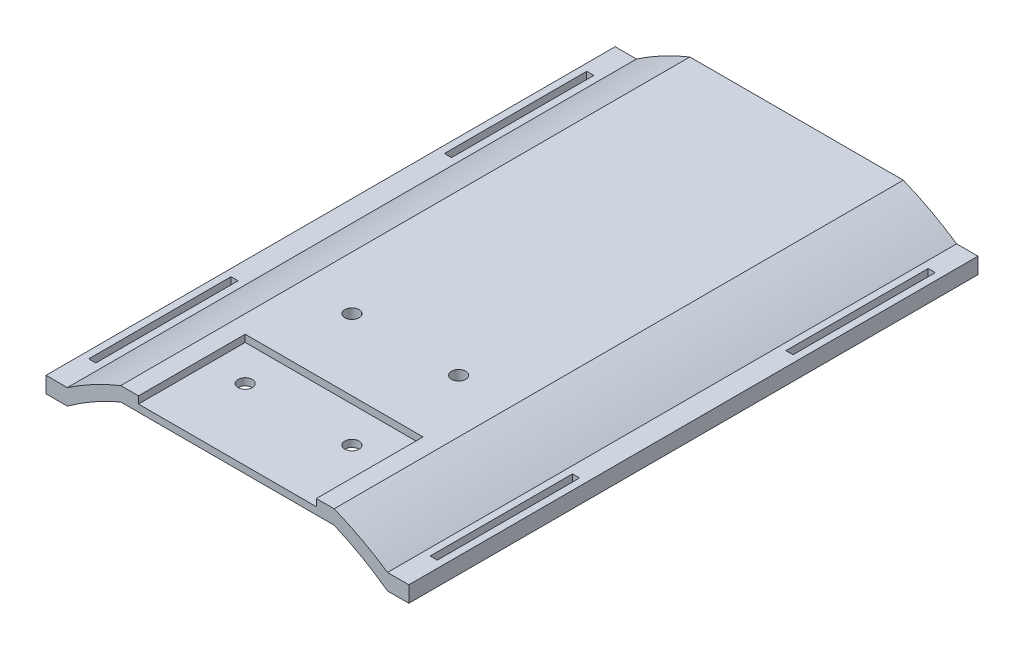
from build123d import *

# Parameters (mm, degrees)
BOSS_EXTRUDE1_DEPTH = 80
SKETCH8_W           = 25
SKETCH8_H           = 15
CUT_EXTRUDE2_DEPTH  = 1
SKETCH9_R           = 1
CUT_EXTRUDE3_DEPTH  = 1
SKETCH12_W          = 1
SKETCH12_H          = 20
CUT_EXTRUDE4_DEPTH  = 4.69
SKETCH13_R          = 1
CUT_EXTRUDE5_DEPTH  = 4.69


with BuildPart() as part:
    # Sketch4 → Boss-Extrude1 (new body)
    with BuildSketch(Plane.XY):
        with BuildLine():
            Line((-19.110677356, 53.885203774), (-16.110677356, 53.885203774))
            ThreePointArc((-16.110677356, 53.885203774), (-12.467042329, 56.084638099), (-8.610677356, 57.885203774))
            Line((-8.610677356, 57.885203774), (21.389322644, 57.885203774))
            ThreePointArc((21.389322644, 57.885203774), (25.245687617, 56.084638099), (28.889322644, 53.885203774))
            Line((28.889322644, 53.885203774), (31.889322644, 53.885203774))
            Line((31.889322644, 53.885203774), (31.889322644, 51.627366583))
            Line((31.889322644, 51.627366583), (28.889322644, 51.627366583))
            ThreePointArc((28.889322644, 51.627366583), (25.259796787, 53.968495283), (21.389322644, 55.885203774))
            Line((21.389322644, 55.885203774), (-8.610677356, 55.885203774))
            ThreePointArc((-8.610677356, 55.885203774), (-12.481151499, 53.968495283), (-16.110677356, 51.627366583))
            Line((-16.110677356, 51.627366583), (-19.110677356, 51.627366583))
            Line((-19.110677356, 51.627366583), (-19.110677356, 53.885203774))
        make_face()
    extrude(amount=BOSS_EXTRUDE1_DEPTH)

    # Sketch8 → Cut-Extrude2 (cut)
    with BuildSketch(Plane(origin=(0, 57.885203774, 0), x_dir=(1, 0, 0), z_dir=(0, 1, 0))):
        with Locations((6.389322644, -72.5)):
            Rectangle(SKETCH8_W, SKETCH8_H)
    extrude(amount=-CUT_EXTRUDE2_DEPTH, mode=Mode.SUBTRACT)

    # Sketch9 → Cut-Extrude3 (cut)
    with BuildSketch(Plane(origin=(0, 56.885203774, 0), x_dir=(1, 0, 0), z_dir=(0, 1, 0))):
        with Locations(Location((-1.110677356, -70, 0), (0, 0, 270))):
            Circle(SKETCH9_R)
        with Locations(Location((13.889322644, -70, 0), (0, 0, 270))):
            Circle(SKETCH9_R)
    extrude(amount=-CUT_EXTRUDE3_DEPTH, mode=Mode.SUBTRACT)

    # Sketch12 → Cut-Extrude4 (cut)
    with BuildSketch(Plane(origin=(0, 53.885203774, 0), x_dir=(1, 0, 0), z_dir=(0, 1, 0))):
        with Locations((-17.610677356, -15)):
            Rectangle(SKETCH12_W, SKETCH12_H)
        with Locations((-17.610677356, -65)):
            Rectangle(SKETCH12_W, SKETCH12_H)
        with Locations((30.389322644, -15)):
            Rectangle(SKETCH12_W, SKETCH12_H)
        with Locations((30.389322644, -65)):
            Rectangle(SKETCH12_W, SKETCH12_H)
    extrude(amount=-CUT_EXTRUDE4_DEPTH, mode=Mode.SUBTRACT)

    # Sketch13 → Cut-Extrude5 (cut)
    with BuildSketch(Plane(origin=(0, 57.885203774, 0), x_dir=(1, 0, 0), z_dir=(0, 1, 0))):
        with Locations(Location((-1.110677356, -55, 0), (0, 0, 270))):
            Circle(SKETCH13_R)
        with Locations(Location((13.889322644, -55, 0), (0, 0, 270))):
            Circle(SKETCH13_R)
    extrude(amount=-CUT_EXTRUDE5_DEPTH, mode=Mode.SUBTRACT)


solid = part.part
